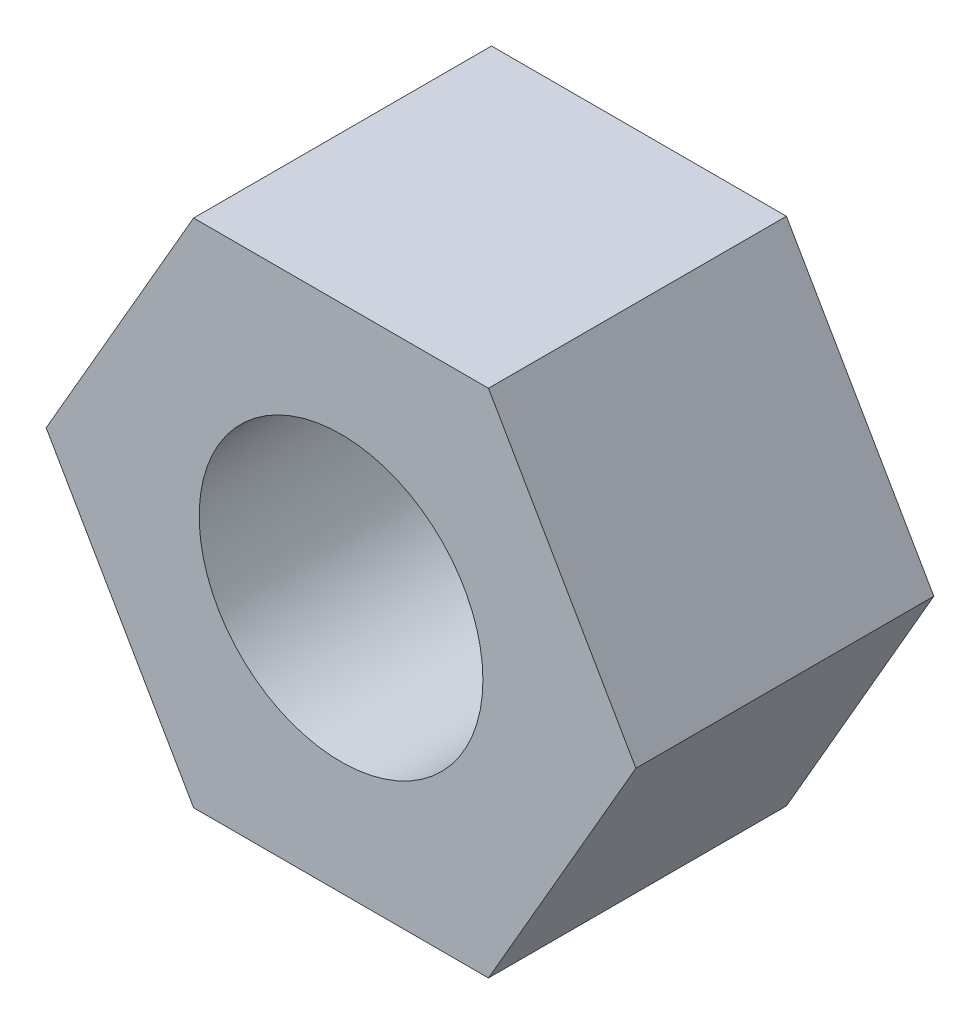
from build123d import *

# Parameters (mm, degrees)
BOSS_EXTRUDE1_DEPTH     = 8.334375
F_3_8_16_TAPPED_HOLE1_D = 7.9375


with BuildPart() as part:
    # Sketch1 → Boss-Extrude1 (new body)
    with BuildSketch(Plane.XY):
        Polygon((-8.248891971, 0), (-4.124445986, -7.14375), (4.124445986, -7.14375), (8.248891971, 0), (4.124445986, 7.14375), (-4.124445986, 7.14375), align=None)
    extrude(amount=BOSS_EXTRUDE1_DEPTH)

    # 3/8-16 Tapped Hole1 (through all)
    with Locations(Plane.XY.offset(8.334375)):
        with Locations((0, 0)):
            Hole(F_3_8_16_TAPPED_HOLE1_D / 2)


solid = part.part
